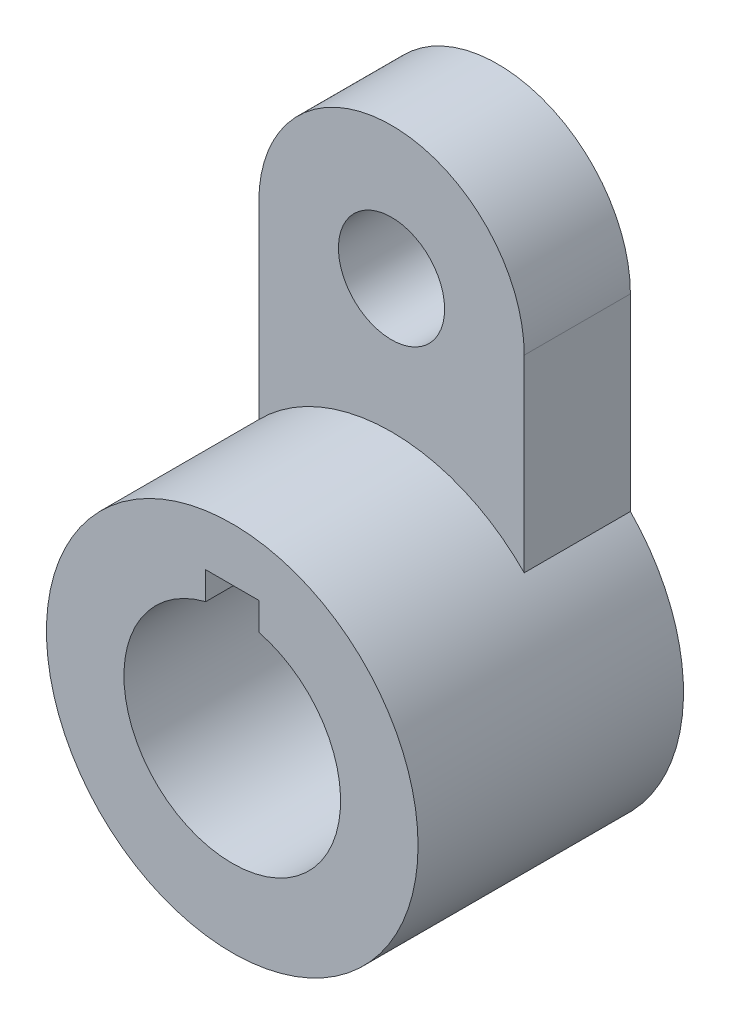
from build123d import *

# Parameters (mm, degrees)
SKETCH1_R           = 22.225
BOSS_EXTRUDE1_DEPTH = 31.75
SKETCH2_R           = 6.35
BOSS_EXTRUDE2_DEPTH = 12.7
CUT_EXTRUDE1_DEPTH  = 67.447827278


with BuildPart() as part:
    # Sketch1 → Boss-Extrude1 (new body)
    with BuildSketch(Plane.XY):
        Circle(SKETCH1_R)
    extrude(amount=BOSS_EXTRUDE1_DEPTH)

    # Sketch2 → Boss-Extrude2 (add)
    with BuildSketch(Plane.XY):
        with BuildLine():
            Line((-15.875, 7.271721018), (15.875, 7.271721018))
            Line((15.875, 7.271721018), (15.875, 38.1))
            ThreePointArc((15.875, 38.1), (0, 53.975), (-15.875, 38.1))
            Line((-15.875, 38.1), (-15.875, 7.271721018))
        make_face()
        with Locations((0, 38.1)):
            Circle(SKETCH2_R, mode=Mode.SUBTRACT)
    extrude(amount=BOSS_EXTRUDE2_DEPTH)

    # Sketch3 → Cut-Extrude1 (cut, through all)
    with BuildSketch(Plane.XY.offset(31.75)):
        with BuildLine():
            Line((-3.175, 12.564048608), (-3.175, 15.875))
            Line((-3.175, 15.875), (3.175, 15.875))
            Line((3.175, 15.875), (3.175, 12.564048608))
            ThreePointArc((3.175, 12.564048608), (0, -12.959010086), (-3.175, 12.564048608))
        make_face()
    extrude(amount=-CUT_EXTRUDE1_DEPTH, mode=Mode.SUBTRACT)


solid = part.part
